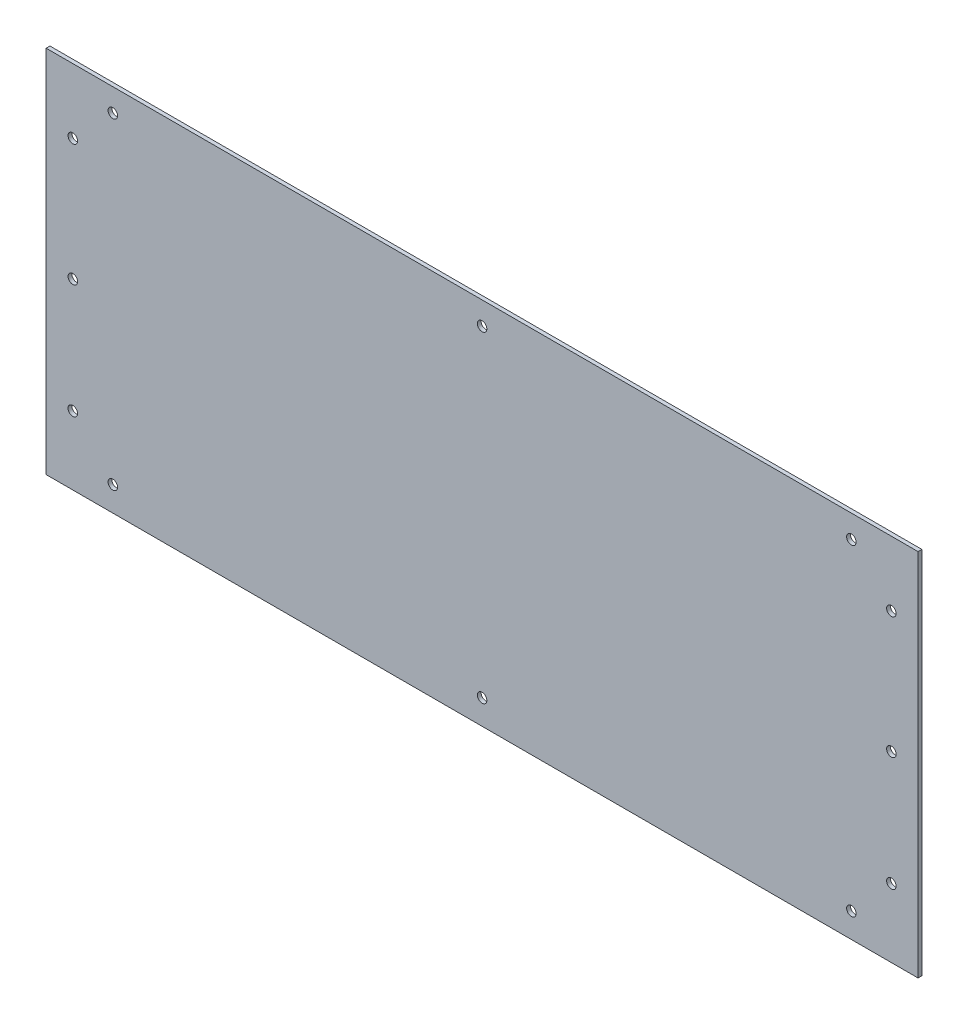
from build123d import *

# Parameters (mm, degrees)
SKETCH1_W           = 458
SKETCH1_H           = 192
BOSS_EXTRUDE1_DEPTH = 2
SKETCH2_R           = 2.5
CUT_EXTRUDE1_DEPTH  = 249.316330514
SKETCH3_W           = 458
SKETCH3_H           = 2
BOSS_EXTRUDE2_DEPTH = 2


with BuildPart() as part:
    # Sketch1 → Boss-Extrude1 (new body)
    with BuildSketch(Plane.XY):
        Rectangle(SKETCH1_W, SKETCH1_H)
    extrude(amount=BOSS_EXTRUDE1_DEPTH)

    # Sketch2 → Cut-Extrude1 (cut, through all)
    with BuildSketch(Plane.XY.offset(2)):
        with Locations((-194, 86)):
            Circle(SKETCH2_R)
        with Locations((-194, -83.004592541)):
            Circle(SKETCH2_R)
        with Locations((194, -83.004592541)):
            Circle(SKETCH2_R)
        with Locations((194, 86)):
            Circle(SKETCH2_R)
        with Locations((-215, 0)):
            Circle(SKETCH2_R)
        with Locations((-215, -60)):
            Circle(SKETCH2_R)
        with Locations((-215, 64)):
            Circle(SKETCH2_R)
        with Locations((215, 0)):
            Circle(SKETCH2_R)
        with Locations((215, -60)):
            Circle(SKETCH2_R)
        with Locations((215, 64)):
            Circle(SKETCH2_R)
        with Locations((0, 86)):
            Circle(SKETCH2_R)
        with Locations((0, -83)):
            Circle(SKETCH2_R)
    extrude(amount=-CUT_EXTRUDE1_DEPTH, mode=Mode.SUBTRACT)

    # Sketch3 → Boss-Extrude2 (add, through all)
    with BuildSketch(Plane.XY.offset(2)):
        with Locations((0, 97)):
            Rectangle(SKETCH3_W, SKETCH3_H)
    extrude(amount=-BOSS_EXTRUDE2_DEPTH)


solid = part.part
